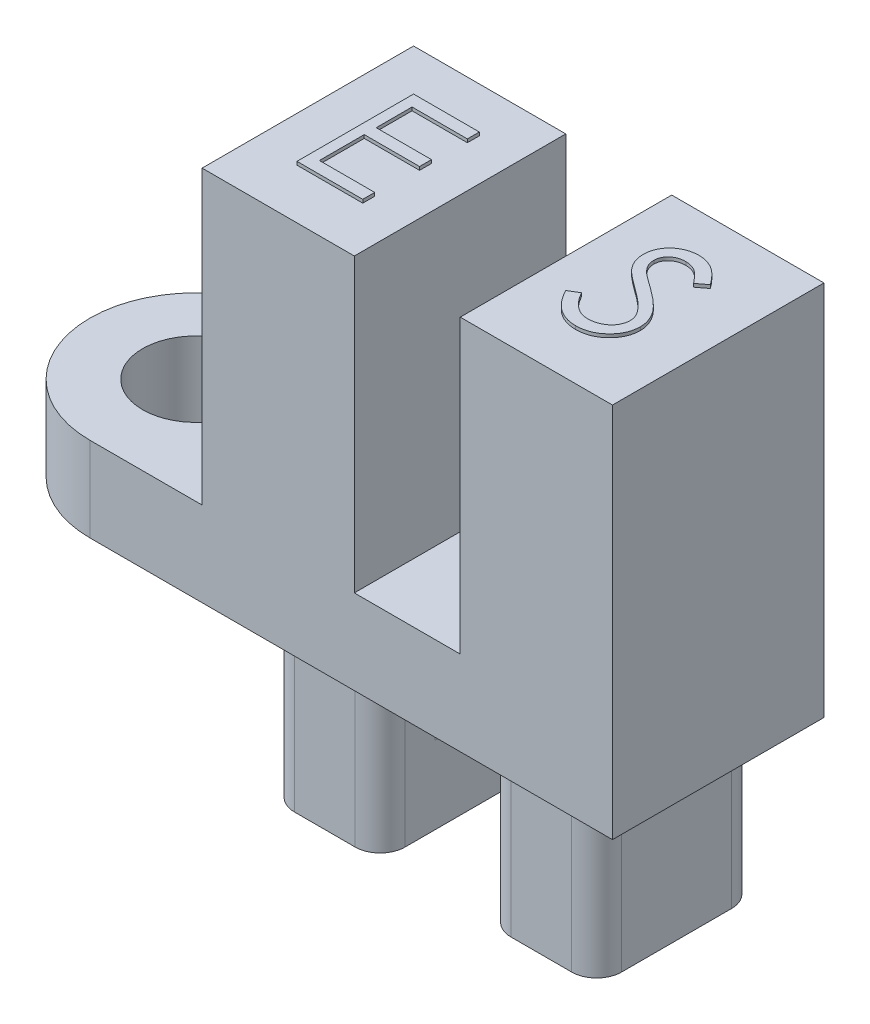
from build123d import *

# Parameters (mm, degrees)
SKETCH1_R                = 1.59
BOSS_EXTRUDE1_DEPTH      = 2.54
SKETCH2_W                = 4.57
SKETCH2_H                = 6.348981954
BOSS_EXTRUDE2_DEPTH      = 8.76
SKETCH3_W                = 3.32
SKETCH3_H                = 4.8
BOSS_EXTRUDE3_DEPTH      = 4.83
BOSS_EXTRUDE5_DEPTH      = 0.75
BOSS_EXTRUDE5_DEPTH_BACK = 0.75
SKETCH7_W                = 10.82
SKETCH7_H                = 5.8
SKETCH7_W_2              = 10.62
SKETCH7_H_2              = 5.6
CUT_EXTRUDE1_DEPTH       = 0.2
FILLET1_R                = 0.75
BOSS_EXTRUDE6_DEPTH      = 0.1


with BuildPart() as part:
    # Sketch1 → Boss-Extrude1 (new body)
    with BuildSketch(Plane(origin=(0, 0, 0), x_dir=(1, 0, 0), z_dir=(0, 1, 0))):
        with BuildLine():
            Line((-9.53, 3.174490977), (0, 3.174490977))
            Line((0, 3.174490977), (6.16, 3.174490977))
            Line((6.16, 3.174490977), (6.16, -3.174490977))
            Line((6.16, -3.174490977), (0, -3.174490977))
            Line((0, -3.174490977), (-9.53, -3.174490977))
            ThreePointArc((-9.53, -3.174490977), (-12.704490977, 0), (-9.53, 3.174490977))
        make_face()
        with Locations(Location((-9.53, 0, 0), (0, 0, 270))):
            Circle(SKETCH1_R, mode=Mode.SUBTRACT)
    extrude(amount=BOSS_EXTRUDE1_DEPTH)

    # Sketch2 → Boss-Extrude2 (add)
    with BuildSketch(Plane(origin=(0, 2.54, 0), x_dir=(1, 0, 0), z_dir=(0, 1, 0))):
        with Locations((-3.875, 0)):
            Rectangle(SKETCH2_W, SKETCH2_H)
        with Locations((3.875, 0)):
            Rectangle(SKETCH2_W, SKETCH2_H)
    extrude(amount=BOSS_EXTRUDE2_DEPTH)

    # Sketch3 → Boss-Extrude3 (add)
    with BuildSketch(Plane.XZ):
        with Locations((3.25, 0)):
            Rectangle(SKETCH3_W, SKETCH3_H)
        with Locations((-3.25, 0)):
            Rectangle(SKETCH3_W, SKETCH3_H)
    extrude(amount=BOSS_EXTRUDE3_DEPTH)

    # Sketch6 → Boss-Extrude5 (add, two sides: drawn at the far end of the back side and taken through both)
    with BuildSketch(Plane.XY.offset(-BOSS_EXTRUDE5_DEPTH_BACK)):
        with BuildLine():
            Line((-1.59, -2.5), (-1.59, 0))
            Line((-1.59, 0), (1.59, 0))
            Line((1.59, 0), (1.59, -2.5))
            ThreePointArc((1.59, -2.5), (0, -0.91), (-1.59, -2.5))
        make_face()
    extrude(amount=BOSS_EXTRUDE5_DEPTH + BOSS_EXTRUDE5_DEPTH_BACK)

    # Sketch7 → Cut-Extrude1 (cut)
    with BuildSketch(Plane.XZ):
        Rectangle(SKETCH7_W, SKETCH7_H)
        Rectangle(SKETCH7_W_2, SKETCH7_H_2, mode=Mode.SUBTRACT)
    extrude(amount=-CUT_EXTRUDE1_DEPTH, mode=Mode.SUBTRACT)

    # Fillet1
    fillet1_edges = [part.edges().sort_by_distance(p)[0] for p in [
        (-1.59, -2.415, -2.4),
        (-1.59, -2.415, 2.4),
        (-4.91, -2.415, 2.4),
        (-4.91, -2.415, -2.4),
        (4.91, -2.415, -2.4),
        (4.91, -2.415, 2.4),
        (1.59, -2.415, 2.4),
        (1.59, -2.415, -2.4),
    ]]
    fillet(fillet1_edges, radius=FILLET1_R)

    # Sketch8 → Boss-Extrude6 (add)
    with BuildSketch(Plane(origin=(0, 11.3, 0), x_dir=(1, 0, 0), z_dir=(0, 1, 0))):
        Polygon((-4.811282051, 1.825509023), (-2.836923077, 1.825509023), (-2.836923077, 1.466534664), (-4.497179487, 1.466534664), (-4.497179487, 0.389611587), (-2.836923077, 0.389611587), (-2.836923077, 0.030637228), (-4.497179487, 0.030637228), (-4.497179487, -1.315516618), (-2.836923077, -1.315516618), (-2.836923077, -1.674490977), (-4.811282051, -1.674490977), align=None)
        with BuildLine():
            Line((2.57974359, -0.999310688), (2.875616987, -0.821926874))
            add(Edge.make_bspline(
                [(2.875616987, -0.821926874), (2.903135224, -0.867991259), (2.955859105, -0.956248843), (3.043810464, -1.075506883), (3.134943375, -1.17686904), (3.229932709, -1.259745648), (3.328198657, -1.324994534), (3.430382711, -1.371196766), (3.536140521, -1.400012742), (3.608114343, -1.403512828), (3.644046474, -1.405260207)],
                knots=[0, 0, 0, 0, 1.272034388, 2.437168799, 3.508375237, 4.49857839, 5.41946034, 6.295179144, 7.148887113, 8, 8, 8, 8], degree=3))
            add(Edge.make_bspline(
                [(3.644046474, -1.405260207), (3.674733335, -1.404405535), (3.735570108, -1.402711145), (3.825132351, -1.386430343), (3.912114153, -1.361418214), (3.994722791, -1.325597282), (4.071818405, -1.282258796), (4.139425101, -1.229912619), (4.197871214, -1.171306413), (4.245680328, -1.105923759), (4.282360364, -1.03560661), (4.310552432, -0.963430659), (4.326197506, -0.88826209), (4.328554259, -0.837651628), (4.32974359, -0.812111169)],
                knots=[0, 0, 0, 0, 1.095163259, 2.171163733, 3.241058638, 4.321873601, 5.38011039, 6.391990106, 7.366004449, 8.327778327, 9.272591725, 10.192022065, 11.087607919, 12, 12, 12, 12], degree=3))
            add(Edge.make_bspline(
                [(4.32974359, -0.812111169), (4.328269279, -0.782970319), (4.325272221, -0.72373123), (4.299940741, -0.636331577), (4.260091494, -0.549839007), (4.22332885, -0.496337742), (4.204242788, -0.468561489)],
                knots=[0, 0, 0, 0, 0.938893495, 1.908633276, 2.914225137, 4, 4, 4, 4], degree=3))
            add(Edge.make_bspline(
                [(4.204242788, -0.468561489), (4.188572174, -0.448514666), (4.15567368, -0.406428867), (4.099116167, -0.343783632), (4.032750053, -0.279165213), (3.958846498, -0.210106156), (3.874713409, -0.139818359), (3.782985895, -0.064950081), (3.681322036, 0.011651496), (3.610022539, 0.063024061), (3.573233173, 0.089531459)],
                knots=[0, 0, 0, 0, 0.722233717, 1.516239348, 2.393582979, 3.351407094, 4.387010283, 5.505090956, 6.712668013, 8, 8, 8, 8], degree=3))
            add(Edge.make_bspline(
                [(3.573233173, 0.089531459), (3.536409177, 0.115760047), (3.4660045, 0.165907109), (3.367545918, 0.240331393), (3.279501455, 0.308375263), (3.202262438, 0.370679275), (3.135862842, 0.427251879), (3.079779431, 0.477549819), (3.035440873, 0.522933379), (3.010785293, 0.552374721), (2.999715545, 0.565593158)],
                knots=[0, 0, 0, 0, 1.452282411, 2.77665338, 3.964542531, 5.026858415, 5.96415736, 6.766646006, 7.446254459, 8, 8, 8, 8], degree=3))
            add(Edge.make_bspline(
                [(2.999715545, 0.565593158), (2.984243, 0.586194195), (2.953814163, 0.626708899), (2.913648157, 0.690033756), (2.879508995, 0.754857022), (2.852746663, 0.821352886), (2.830210444, 0.888587815), (2.815052513, 0.957439061), (2.805561116, 1.027597679), (2.80458913, 1.07481118), (2.804102564, 1.098445722)],
                knots=[0, 0, 0, 0, 1.068054152, 2.10047183, 3.106115577, 4.101338837, 5.06977816, 6.043150881, 7.020423561, 8, 8, 8, 8], degree=3))
            add(Edge.make_bspline(
                [(2.804102564, 1.098445722), (2.805407773, 1.135475497), (2.807990293, 1.20874356), (2.82983081, 1.315774391), (2.864303704, 1.417960808), (2.912598592, 1.514291142), (2.974855945, 1.602257123), (3.046901919, 1.68287061), (3.132713405, 1.750639192), (3.226866029, 1.80985125), (3.329922401, 1.856197175), (3.437913304, 1.891158156), (3.551010376, 1.910967413), (3.627613511, 1.913810178), (3.666482372, 1.915252613)],
                knots=[0, 0, 0, 0, 1.005424448, 1.989358655, 2.955360095, 3.929531133, 4.905563448, 5.876582895, 6.856512386, 7.866279853, 8.892233794, 9.918561126, 10.94386622, 12, 12, 12, 12], degree=3))
            add(Edge.make_bspline(
                [(3.666482372, 1.915252613), (3.707726472, 1.913830061), (3.789747824, 1.91100106), (3.910397039, 1.886403529), (4.026557756, 1.845702857), (4.120001021, 1.799514199), (4.193133782, 1.753382784), (4.248906515, 1.711362959), (4.305423966, 1.662987851), (4.36314202, 1.608128605), (4.42108268, 1.546281854), (4.480106132, 1.477871165), (4.540350401, 1.403314609), (4.579106261, 1.350090108), (4.598974359, 1.322804696)],
                knots=[0, 0, 0, 0, 1.286793592, 2.559021753, 3.825965368, 5.121522368, 5.803751409, 6.523245864, 7.299691795, 8.125521123, 9.008227632, 9.944561021, 10.946284179, 12, 12, 12, 12], degree=3))
            Line((4.598974359, 1.322804696), (4.315020032, 1.107560305))
            add(Edge.make_bspline(
                [(4.315020032, 1.107560305), (4.2978741, 1.129648996), (4.264855043, 1.172186649), (4.214725556, 1.231757965), (4.167476908, 1.286174444), (4.120926508, 1.333439572), (4.077532876, 1.376141706), (4.035415834, 1.412701462), (3.995181483, 1.443477058), (3.944464572, 1.476320618), (3.880746854, 1.508877121), (3.800762318, 1.536426199), (3.717176043, 1.552981261), (3.660246411, 1.555170149), (3.631426282, 1.556278254)],
                knots=[0, 0, 0, 0, 1.181633172, 2.275549214, 3.290209073, 4.226197932, 5.078386478, 5.862611352, 6.581680152, 7.217281963, 8.414376989, 9.595101626, 10.782541182, 12, 12, 12, 12], degree=3))
            add(Edge.make_bspline(
                [(3.631426282, 1.556278254), (3.59526976, 1.555066554), (3.525545312, 1.552729905), (3.426555076, 1.52720992), (3.337461151, 1.487028059), (3.260908586, 1.430713081), (3.197171609, 1.363992089), (3.15106615, 1.287213233), (3.123315986, 1.202430831), (3.119929706, 1.143289175), (3.118205128, 1.11316928)],
                knots=[0, 0, 0, 0, 1.14458467, 2.207223713, 3.21896685, 4.227309161, 5.202851033, 6.127160689, 7.046193047, 8, 8, 8, 8], degree=3))
            add(Edge.make_bspline(
                [(3.118205128, 1.11316928), (3.118598255, 1.094417801), (3.119385151, 1.056884182), (3.130359949, 1.00143276), (3.144459278, 0.94612142), (3.166801909, 0.891198838), (3.197647213, 0.835704478), (3.238152389, 0.778682741), (3.289165701, 0.719631032), (3.328242713, 0.681223658), (3.348874199, 0.660945722)],
                knots=[0, 0, 0, 0, 0.858281714, 1.717966888, 2.583508476, 3.4729293, 4.427298488, 5.488583878, 6.674047936, 8, 8, 8, 8], degree=3))
            add(Edge.make_bspline(
                [(3.348874199, 0.660945722), (3.356535571, 0.654108696), (3.374737238, 0.637865488), (3.408013164, 0.611273207), (3.451955962, 0.578470435), (3.505418163, 0.537883118), (3.569385525, 0.490801656), (3.643865081, 0.437828044), (3.728026614, 0.377242585), (3.78774853, 0.334885045), (3.819326923, 0.31248819)],
                knots=[0, 0, 0, 0, 0.420754252, 0.999615792, 1.744751191, 2.668019286, 3.750313428, 4.999500688, 6.413464383, 8, 8, 8, 8], degree=3))
            add(Edge.make_bspline(
                [(3.819326923, 0.31248819), (3.857312836, 0.28484683), (3.930867293, 0.231323169), (4.035524873, 0.150907489), (4.130418681, 0.07225972), (4.215881884, -0.004117887), (4.292758793, -0.07764598), (4.360196513, -0.14920916), (4.418882194, -0.218294733), (4.482061412, -0.306867309), (4.546619232, -0.415648393), (4.602060739, -0.548926632), (4.637019087, -0.682722952), (4.641590602, -0.772649789), (4.643846154, -0.817019022)],
                knots=[0, 0, 0, 0, 1.163667725, 2.253281268, 3.268753668, 4.215851969, 5.092017293, 5.902905408, 6.650798638, 7.335211899, 8.59617414, 9.77448103, 10.901945474, 12, 12, 12, 12], degree=3))
            add(Edge.make_bspline(
                [(4.643846154, -0.817019022), (4.643189016, -0.848397387), (4.641887501, -0.91054477), (4.626926587, -1.001799847), (4.605006922, -1.090430717), (4.571969688, -1.175341829), (4.53164653, -1.258086592), (4.480480282, -1.336494492), (4.421172597, -1.412300891), (4.353138832, -1.483484382), (4.27869293, -1.548830578), (4.200009235, -1.60695964), (4.116958962, -1.655427963), (4.029992645, -1.694978805), (3.939090309, -1.725912323), (3.844282525, -1.748325192), (3.745413014, -1.762080903), (3.678212532, -1.763508664), (3.644046474, -1.764234566)],
                knots=[0, 0, 0, 0, 0.983748083, 1.948392443, 2.894712957, 3.844097841, 4.80183111, 5.778335162, 6.776009319, 7.81870978, 8.863265674, 9.881300176, 10.883814829, 11.87499822, 12.874611388, 13.892143829, 14.928324115, 16, 16, 16, 16], degree=3))
            add(Edge.make_bspline(
                [(3.644046474, -1.764234566), (3.617611131, -1.763723385), (3.565073371, -1.762707459), (3.487363889, -1.753726179), (3.4112243, -1.741019075), (3.337610018, -1.720845005), (3.265572607, -1.696368028), (3.195425372, -1.666229696), (3.127134318, -1.630112494), (3.060316735, -1.58881747), (2.995142561, -1.540759725), (2.932223093, -1.484786229), (2.869493907, -1.422440724), (2.808806511, -1.35203016), (2.748933367, -1.274692078), (2.691054957, -1.189702894), (2.633973239, -1.09752554), (2.598157772, -1.032660455), (2.57974359, -0.999310688)],
                knots=[0, 0, 0, 0, 0.915332311, 1.819136955, 2.706846663, 3.586547465, 4.459518054, 5.340707479, 6.227863349, 7.133153174, 8.059268498, 9.028702269, 10.047606654, 11.120612155, 12.245963614, 13.433783089, 14.680604001, 16, 16, 16, 16], degree=3))
        make_face()
    extrude(amount=BOSS_EXTRUDE6_DEPTH)


solid = part.part
